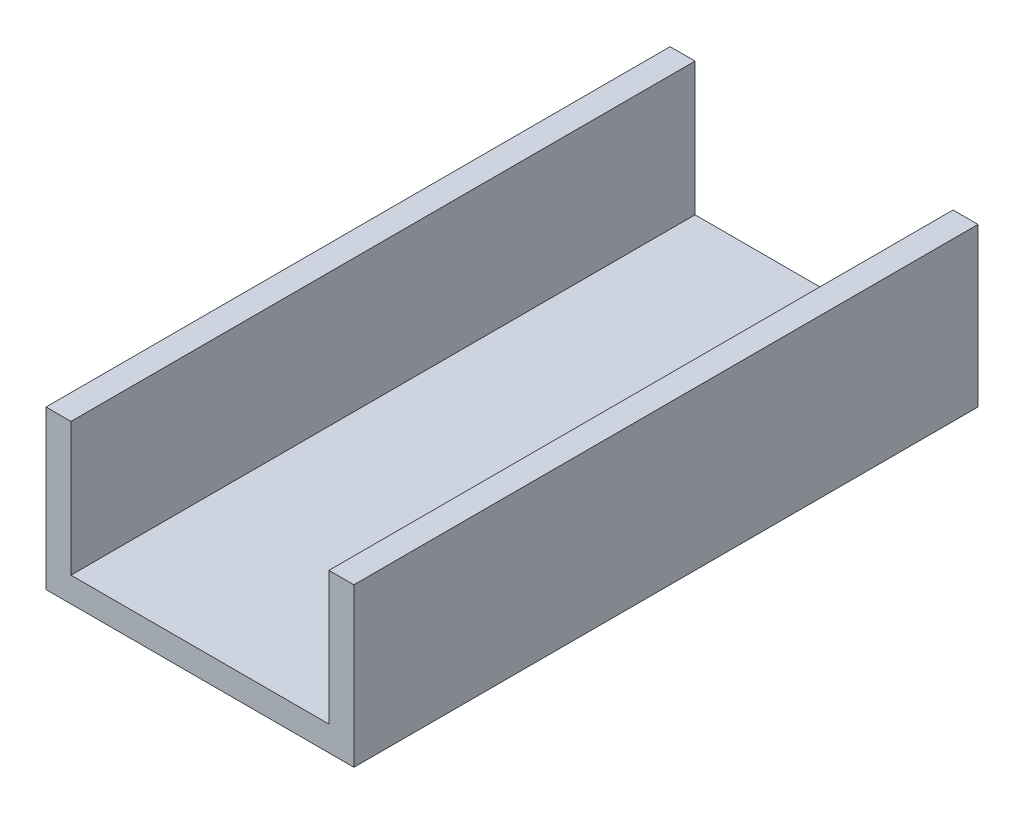
from build123d import *

# Parameters (mm, degrees)
ESBO_O1_W       = 18.5
ESBO_O1_H       = 39
EXTRUS_O1_DEPTH = 1.5
EXTRUS_O2_DEPTH = 8
ESBO_O3_W       = 18.5
ESBO_O3_H       = 1.5
EXTRUS_O3_DEPTH = 24.580977503


with BuildPart() as part:
    # Esboço1 → Extrusão1 (new body)
    with BuildSketch(Plane(origin=(0, 0, 0), x_dir=(1, 0, 0), z_dir=(0, 1, 0))):
        Rectangle(ESBO_O1_W, ESBO_O1_H)
    extrude(amount=EXTRUS_O1_DEPTH)

    # Esboço2 → Extrusão2 (add)
    with BuildSketch(Plane(origin=(0, 1.5, 0), x_dir=(1, 0, 0), z_dir=(0, 1, 0))):
        Polygon((7.75, 19.5), (9.25, 19.5), (9.25, -19.5), (-9.25, -19.5), (-9.25, 19.5), (-7.75, 19.5), (-7.75, -18), (7.75, -18), align=None)
    extrude(amount=EXTRUS_O2_DEPTH)

    # Esboço3 → Extrusão3 (cut, through all)
    with BuildSketch(Plane(origin=(0, 9.5, 0), x_dir=(1, 0, 0), z_dir=(0, 1, 0))):
        with Locations((0, -18.75)):
            Rectangle(ESBO_O3_W, ESBO_O3_H)
    extrude(amount=-EXTRUS_O3_DEPTH, mode=Mode.SUBTRACT)


solid = part.part
